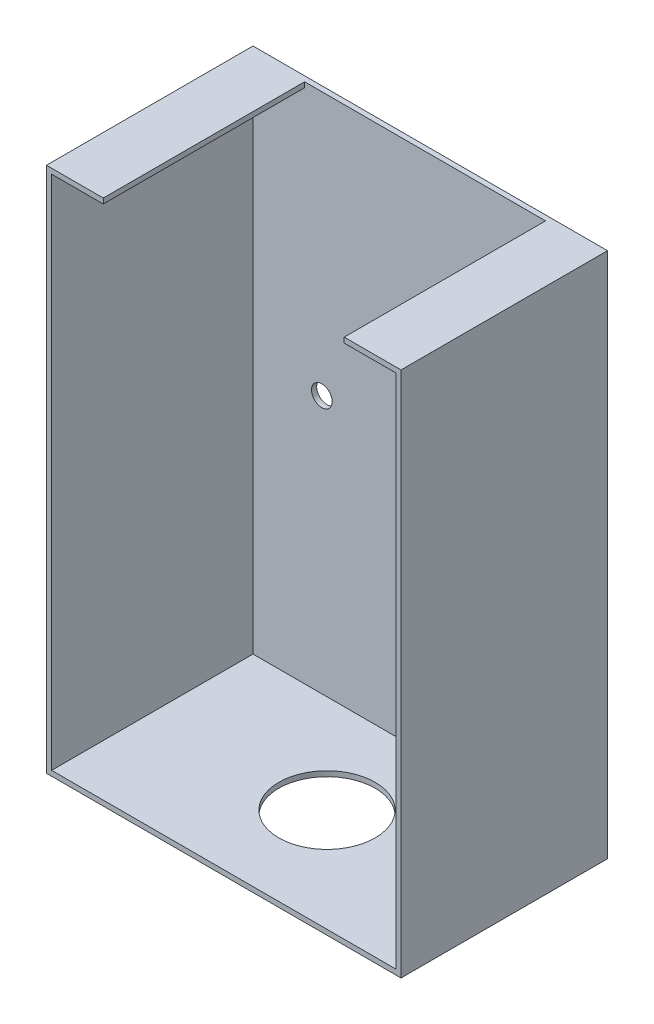
from build123d import *

# Parameters (mm, degrees)
SKETCH1_W           = 103
SKETCH1_H           = 153
BOSS_EXTRUDE1_DEPTH = 60
SHELL1_T            = -1.5
CUT_EXTRUDE1_REACH  = 174.224
SKETCH2_R           = 14
SKETCH3_W           = 58.5
SKETCH3_H           = 1.5
BOSS_EXTRUDE2_DEPTH = 15
CUT_EXTRUDE2_REACH  = 112.02
SKETCH4_R           = 3


with BuildPart() as part:
    # Sketch1 → Boss-Extrude1 (new body)
    with BuildSketch(Plane.XY):
        Rectangle(SKETCH1_W, SKETCH1_H)
    extrude(amount=BOSS_EXTRUDE1_DEPTH)

    # Shell1
    shell1_openings = [part.faces().sort_by_distance(p)[0] for p in [
        (0, 0, 60),
        (0, 76.5, 30),
    ]]
    offset(amount=SHELL1_T, openings=shell1_openings, kind=Kind.INTERSECTION)

    # Sketch2 → Cut-Extrude1 (cut, up to next)
    with BuildSketch(Plane.XZ.offset(76.5), mode=Mode.PRIVATE) as cut_extrude1_sk1:
        with Locations(Location((0, 30, 0), (0, 0, 270))):
            Circle(SKETCH2_R)
    cut_extrude1_tool1 = extrude(cut_extrude1_sk1.sketch, amount=-CUT_EXTRUDE1_REACH, mode=Mode.PRIVATE) & part.part
    add(cut_extrude1_tool1.solids().sort_by_distance((0, -76.5, 30))[0], mode=Mode.SUBTRACT)

    # Sketch3 → Boss-Extrude2 (add)
    with BuildSketch(Plane.ZY.offset(-50)):
        with Locations((30.75, 75.75)):
            Rectangle(SKETCH3_W, SKETCH3_H)
    boss_extrude2 = extrude(amount=BOSS_EXTRUDE2_DEPTH)

    # Mirror1: Boss-Extrude2 across plane
    add(boss_extrude2.mirror(Plane(origin=(0, 0, 0), x_dir=(0, 0, 1), z_dir=(1, 0, 0))))

    # Sketch4 → Cut-Extrude2 (cut, up to next)
    with BuildSketch(Plane(origin=(0, 0, 0), x_dir=(-1, 0, 0), z_dir=(0, 0, -1)), mode=Mode.PRIVATE) as cut_extrude2_sk1:
        with Locations((-30, 0)):
            Circle(SKETCH4_R)
    cut_extrude2_tool1 = extrude(cut_extrude2_sk1.sketch, amount=-CUT_EXTRUDE2_REACH, mode=Mode.PRIVATE) & part.part
    # Sketch4 → Cut-Extrude2 (cut, up to next)
    with BuildSketch(Plane(origin=(0, 0, 0), x_dir=(-1, 0, 0), z_dir=(0, 0, -1)), mode=Mode.PRIVATE) as cut_extrude2_sk2:
        with Locations(Location((30, 0, 0), (0, 0, 180))):
            Circle(SKETCH4_R)
    cut_extrude2_tool2 = extrude(cut_extrude2_sk2.sketch, amount=-CUT_EXTRUDE2_REACH, mode=Mode.PRIVATE) & part.part
    add(cut_extrude2_tool1.solids().sort_by_distance((30, 0, 0))[0], mode=Mode.SUBTRACT)
    add(cut_extrude2_tool2.solids().sort_by_distance((-30, 0, 0))[0], mode=Mode.SUBTRACT)


solid = part.part
